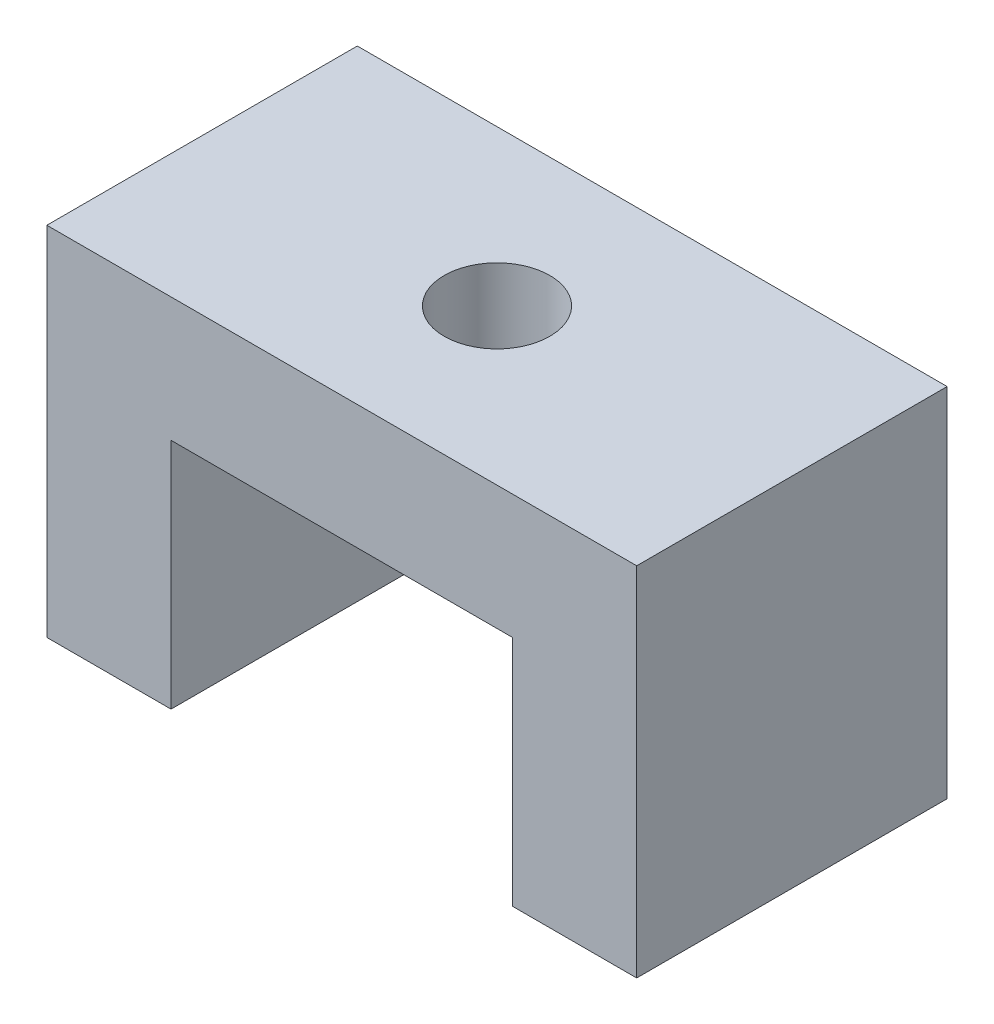
from build123d import *

# Parameters (mm, degrees)
ESQUISSE1_W             = 8
ESQUISSE1_H             = 20
BOSS_EXTRU_1_DEPTH      = 15
BOSS_EXTRU_1_2_DEPTH    = 15
ESQUISSE3_W             = 38
ESQUISSE3_H             = 20
BOSS_EXTRU_2_DEPTH      = 8
ESQUISSE4_R             = 3.4
ENL_V_MAT_EXTRU_1_DEPTH = 10
ESQUISSE1_3_R           = 2
ENL_V_MAT_EXTRU_3_DEPTH = 15


with BuildPart() as part:
    # Esquisse1 → Boss.-Extru.1 (new body)
    with BuildSketch(Plane(origin=(0, 0, 0), x_dir=(1, 0, 0), z_dir=(0, 1, 0))):
        with Locations((-15, 0)):
            Rectangle(ESQUISSE1_W, ESQUISSE1_H)
    extrude(amount=BOSS_EXTRU_1_DEPTH)



with BuildPart() as body_2:
    # Esquisse1 → Boss.-Extru.1 2 (new body)
    with BuildSketch(Plane(origin=(0, 0, 0), x_dir=(1, 0, 0), z_dir=(0, 1, 0))):
        with Locations((15, 0)):
            Rectangle(ESQUISSE1_W, ESQUISSE1_H)
    extrude(amount=BOSS_EXTRU_1_2_DEPTH)


with BuildPart() as part_1:
    add(part.part)

    add(body_2.part)  # Boss.-Extru.2 merges body 2
    # Esquisse3 → Boss.-Extru.2 (add)
    with BuildSketch(Plane(origin=(0, 15, 0), x_dir=(1, 0, 0), z_dir=(0, 1, 0))):
        Rectangle(ESQUISSE3_W, ESQUISSE3_H)
    extrude(amount=BOSS_EXTRU_2_DEPTH)

    # Esquisse4 → Enlèv. mat.-Extru.1 (cut)
    with BuildSketch(Plane(origin=(0, 23, 0), x_dir=(1, 0, 0), z_dir=(0, 1, 0))):
        Circle(ESQUISSE4_R)
    extrude(amount=-ENL_V_MAT_EXTRU_1_DEPTH, mode=Mode.SUBTRACT)

    # Esquisse1<3> → Enlèv. mat.-Extru.3 (cut)
    with BuildSketch(Plane(origin=(0, 0, 0), x_dir=(1, 0, 0), z_dir=(0, 1, 0))):
        with Locations((-15, 0)):
            Circle(ESQUISSE1_3_R)
        with Locations((15, 0)):
            Circle(ESQUISSE1_3_R)
    extrude(amount=ENL_V_MAT_EXTRU_3_DEPTH, mode=Mode.SUBTRACT)


solid = part_1.part
